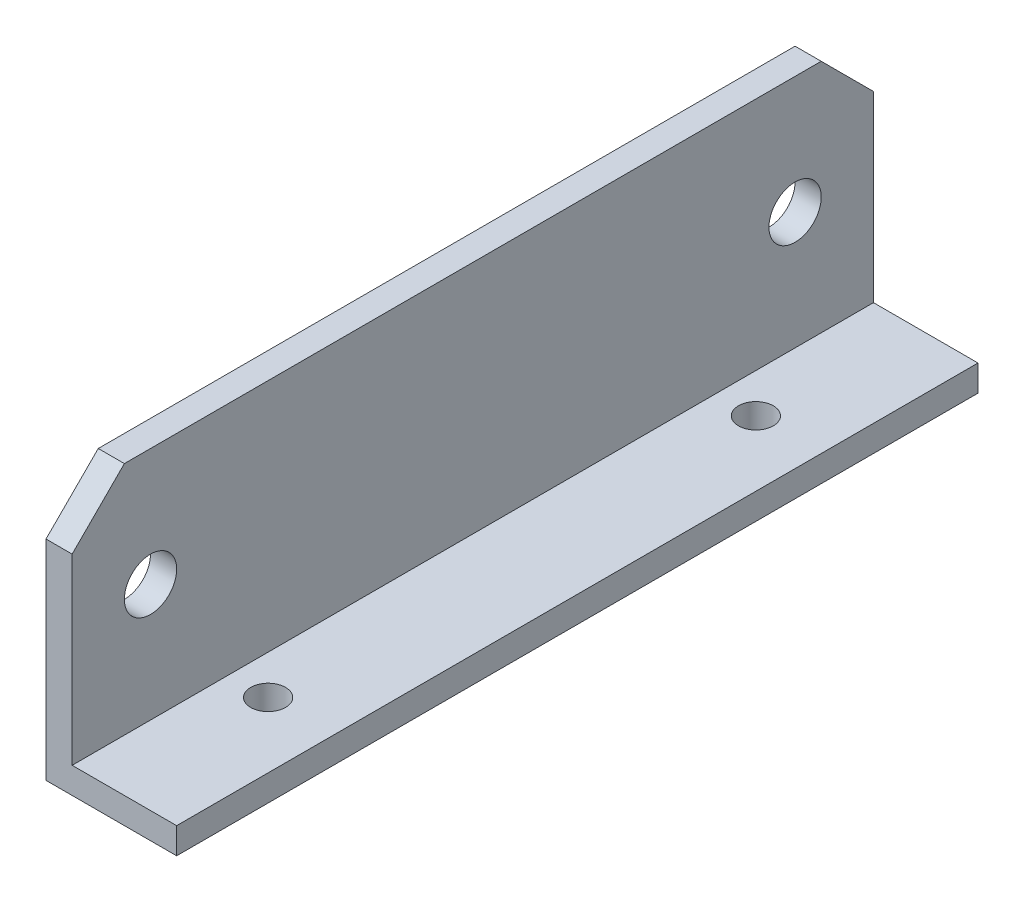
from build123d import *

# Parameters (mm, degrees)
EXTRUDE_THIN1_DEPTH = 46
SKETCH2_R           = 1
CUT_EXTRUDE1_DEPTH  = 49.523190332
SKETCH3_R           = 1.5
CUT_EXTRUDE2_DEPTH  = 49.961719741
CUT_EXTRUDE3_DEPTH  = 49.961719741


with BuildPart() as part:
    # Sketch1 → Extrude-Thin1 (new body)
    with BuildSketch(Plane.XY):
        Polygon((0, 15), (0, 0), (7.5, 0), (7.5, 1.5), (1.5, 1.5), (1.5, 15), align=None)
    extrude(amount=EXTRUDE_THIN1_DEPTH)

    # Sketch2 → Cut-Extrude1 (cut, through all)
    with BuildSketch(Plane(origin=(0, 1.5, 0), x_dir=(1, 0, 0), z_dir=(0, 1, 0))):
        with Locations(Location((3.75, -9, 0), (0, 0, 270))):
            Circle(SKETCH2_R)
        with Locations(Location((3.75, -37, 0), (0, 0, 90))):
            Circle(SKETCH2_R)
    extrude(amount=-CUT_EXTRUDE1_DEPTH, mode=Mode.SUBTRACT)

    # Sketch3 → Cut-Extrude2 (cut, through all)
    with BuildSketch(Plane.ZY):
        with Locations((41.5, 8.25)):
            Circle(SKETCH3_R)
        with Locations((4.5, 8.25)):
            Circle(SKETCH3_R)
    extrude(amount=-CUT_EXTRUDE2_DEPTH, mode=Mode.SUBTRACT)

    # Sketch4 → Cut-Extrude3 (cut, through all)
    with BuildSketch(Plane.ZY):
        Polygon((0, 12), (3, 15), (0, 15), align=None)
        Polygon((46, 15), (43, 15), (46, 12), align=None)
    extrude(amount=-CUT_EXTRUDE3_DEPTH, mode=Mode.SUBTRACT)


solid = part.part
